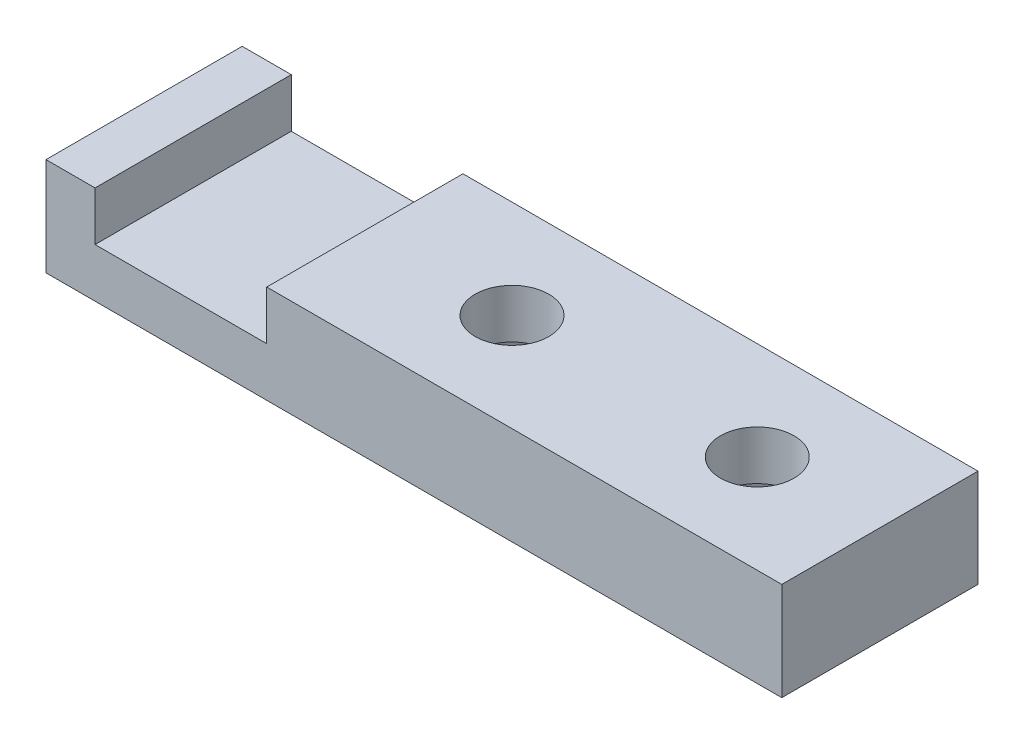
from build123d import *

# Parameters (mm, degrees)
SKETCH1_W           = 20
SKETCH1_H           = 4
BOSS_EXTRUDE1_DEPTH = 8
SKETCH2_W           = 7
SKETCH2_H           = 2
CUT_EXTRUDE1_DEPTH  = 8
SKETCH3_W           = 8
SKETCH3_H           = 4
BOSS_EXTRUDE2_DEPTH = 10
SKETCH4_R           = 1.5
CUT_EXTRUDE2_DEPTH  = 10
CUT_EXTRUDE3_DEPTH  = 2


with BuildPart() as part:
    # Sketch1 → Boss-Extrude1 (new body)
    with BuildSketch(Plane.XY):
        with Locations((10, 2)):
            Rectangle(SKETCH1_W, SKETCH1_H)
    extrude(amount=BOSS_EXTRUDE1_DEPTH)

    # Sketch2 → Cut-Extrude1 (cut)
    with BuildSketch(Plane.XY.offset(8)):
        with Locations((5.5, 3)):
            Rectangle(SKETCH2_W, SKETCH2_H)
    extrude(amount=-CUT_EXTRUDE1_DEPTH, mode=Mode.SUBTRACT)

    # Sketch3 → Boss-Extrude2 (add)
    with BuildSketch(Plane(origin=(20, 0, 0), x_dir=(0, 0, -1), z_dir=(1, 0, 0))):
        with Locations((-4, 2)):
            Rectangle(SKETCH3_W, SKETCH3_H)
    extrude(amount=BOSS_EXTRUDE2_DEPTH)

    # Sketch4 → Cut-Extrude2 (cut)
    with BuildSketch(Plane.XZ):
        with Locations(Location((25, 4, 0), (0, 0, 270))):
            Circle(SKETCH4_R)
        with Locations(Location((15, 4, 0), (0, 0, 270))):
            Circle(SKETCH4_R)
    extrude(amount=-CUT_EXTRUDE2_DEPTH, mode=Mode.SUBTRACT)

    # Sketch5 → Cut-Extrude3 (cut)
    with BuildSketch(Plane.XZ):
        Polygon((22, 4), (23.5, 1.401923789), (26.5, 1.401923789), (28, 4), (26.5, 6.598076211), (23.5, 6.598076211), align=None)
        Polygon((12, 4), (13.5, 1.401923789), (16.5, 1.401923789), (18, 4), (16.5, 6.598076211), (13.5, 6.598076211), align=None)
    extrude(amount=-CUT_EXTRUDE3_DEPTH, mode=Mode.SUBTRACT)


solid = part.part
